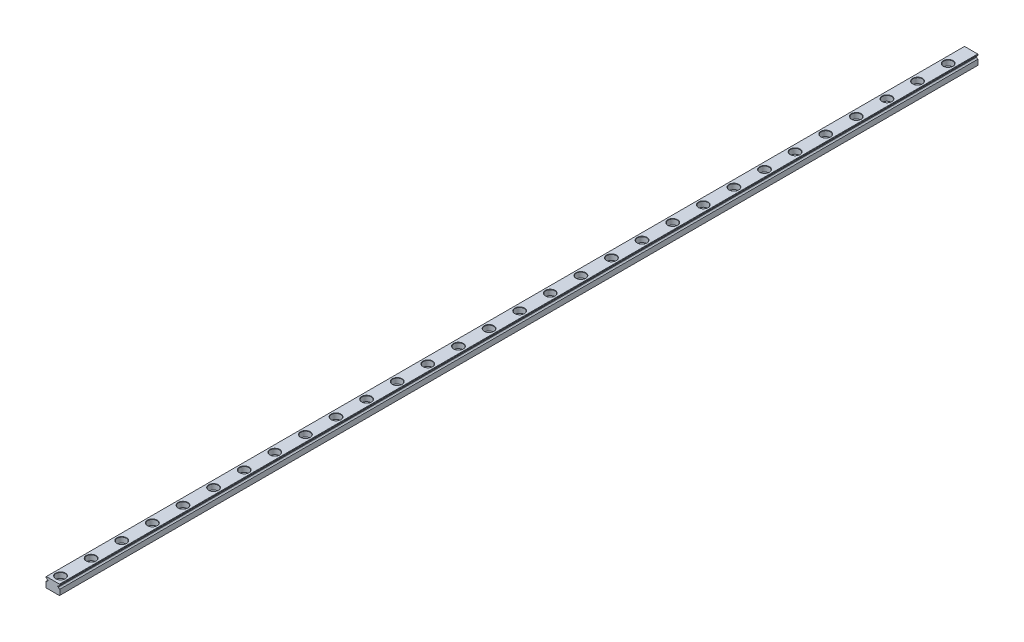
from build123d import *

# Parameters (mm, degrees)
EXTRUDE1_DEPTH             = 600
EXTRUDE2_REACH             = 602.052
SKETCH2_R                  = 1.75
SKETCH_R                   = 3
SKETCH_R_2                 = 1.75
EXTRUDE4_DEPTH             = 3.5
CHAMFER1_SIZE              = 0.2
LPATTERN1_COUNT            = 30
LPATTERN1_PITCH            = 20
CHAMFER1_OF_LPATTERN1_SIZE = 0.2


with BuildPart() as part:
    # Sketch1 → Extrude1 (new body)
    with BuildSketch(Plane.XY):
        with BuildLine():
            Line((-4.3, -3.25), (4.3, -3.25))
            Line((4.3, -3.25), (4.5, -3.05))
            Line((4.5, -3.05), (4.5, 0.455012563))
            ThreePointArc((4.5, 0.455012563), (3.924845827, 0.712323349), (3.617735397, 1.2625))
            Line((3.617735397, 1.2625), (3.15008224, 1.2625))
            Line((3.15008224, 1.2625), (3.15008224, 1.7625))
            Line((3.15008224, 1.7625), (3.65008224, 1.7625))
            ThreePointArc((3.65008224, 1.7625), (3.973877727, 2.229724887), (4.5, 2.444987437))
            Line((4.5, 2.444987437), (4.5, 3.05))
            Line((4.5, 3.05), (4.3, 3.25))
            Line((4.3, 3.25), (-4.3, 3.25))
            Line((-4.3, 3.25), (-4.5, 3.05))
            Line((-4.5, 3.05), (-4.5, 2.444987437))
            ThreePointArc((-4.5, 2.444987437), (-3.973877727, 2.229724887), (-3.65008224, 1.7625))
            Line((-3.65008224, 1.7625), (-3.15008224, 1.7625))
            Line((-3.15008224, 1.7625), (-3.15008224, 1.2625))
            Line((-3.15008224, 1.2625), (-3.617735397, 1.2625))
            ThreePointArc((-3.617735397, 1.2625), (-3.924845827, 0.712323349), (-4.5, 0.455012563))
            Line((-4.5, 0.455012563), (-4.5, -3.05))
            Line((-4.5, -3.05), (-4.3, -3.25))
        make_face()
    extrude(amount=EXTRUDE1_DEPTH)

    # Sketch2 → Extrude2 (cut, up to next)
    with BuildSketch(Plane(origin=(0, 3.25, 0), x_dir=(1, 0, 0), z_dir=(0, 1, 0)), mode=Mode.PRIVATE) as extrude2_sk1:
        with Locations(Location((0, -15, 0), (0, 0, 270))):
            Circle(SKETCH2_R)
    extrude2_tool1 = extrude(extrude2_sk1.sketch, amount=-EXTRUDE2_REACH, mode=Mode.PRIVATE) & part.part
    extrude2 = extrude2_tool1.solids().sort_by_distance((0, 3.25, 15))[0]
    add(extrude2, mode=Mode.SUBTRACT)

    # Sketch → Extrude4 (cut)
    with BuildSketch(Plane(origin=(0, 3.25, 0), x_dir=(1, 0, 0), z_dir=(0, 1, 0))):
        with Locations(Location((0, -15, 0), (0, 0, 270))):
            Circle(SKETCH_R)
        with Locations(Location((0, -15, 0), (0, 0, 270))):
            Circle(SKETCH_R_2, mode=Mode.SUBTRACT)
    extrude4 = extrude(amount=-EXTRUDE4_DEPTH, mode=Mode.SUBTRACT)

    # Chamfer1
    chamfer1_edges = [part.edges().sort_by_distance(p)[0] for p in [
        (0, -3.25, 13.25),
        (0, 3.25, 12),
    ]]
    chamfer(chamfer1_edges, length=CHAMFER1_SIZE)

    # LPattern1: Extrude2, Extrude4 ×30
    with Locations(*[(0, 0, i * LPATTERN1_PITCH) for i in range(1, LPATTERN1_COUNT)]):
        add(extrude2, mode=Mode.SUBTRACT)
        add(extrude4, mode=Mode.SUBTRACT)

    # Chamfer1 of LPattern1
    chamfer1_of_lpattern1_edges = [part.edges().sort_by_distance(p)[0] for p in [
        (0, -3.25, 33.25),
        (0, 3.25, 32),
        (0, -3.25, 53.25),
        (0, 3.25, 52),
        (0, -3.25, 73.25),
        (0, 3.25, 72),
        (0, -3.25, 93.25),
        (0, 3.25, 92),
        (0, -3.25, 113.25),
        (0, 3.25, 112),
        (0, -3.25, 133.25),
        (0, 3.25, 132),
        (0, -3.25, 153.25),
        (0, 3.25, 152),
        (0, -3.25, 173.25),
        (0, 3.25, 172),
        (0, -3.25, 193.25),
        (0, 3.25, 192),
        (0, -3.25, 213.25),
        (0, 3.25, 212),
        (0, -3.25, 233.25),
        (0, 3.25, 232),
        (0, -3.25, 253.25),
        (0, 3.25, 252),
        (0, -3.25, 273.25),
        (0, 3.25, 272),
        (0, -3.25, 293.25),
        (0, 3.25, 292),
        (0, -3.25, 313.25),
        (0, 3.25, 312),
        (0, -3.25, 333.25),
        (0, 3.25, 332),
        (0, -3.25, 353.25),
        (0, 3.25, 352),
        (0, -3.25, 373.25),
        (0, 3.25, 372),
        (0, -3.25, 393.25),
        (0, 3.25, 392),
        (0, -3.25, 413.25),
        (0, 3.25, 412),
        (0, -3.25, 433.25),
        (0, 3.25, 432),
        (0, -3.25, 453.25),
        (0, 3.25, 452),
        (0, -3.25, 473.25),
        (0, 3.25, 472),
        (0, -3.25, 493.25),
        (0, 3.25, 492),
        (0, -3.25, 513.25),
        (0, 3.25, 512),
        (0, -3.25, 533.25),
        (0, 3.25, 532),
        (0, -3.25, 553.25),
        (0, 3.25, 552),
        (0, -3.25, 573.25),
        (0, 3.25, 572),
        (0, -3.25, 593.25),
        (0, 3.25, 592),
    ]]
    chamfer(chamfer1_of_lpattern1_edges, length=CHAMFER1_OF_LPATTERN1_SIZE)


solid = part.part
